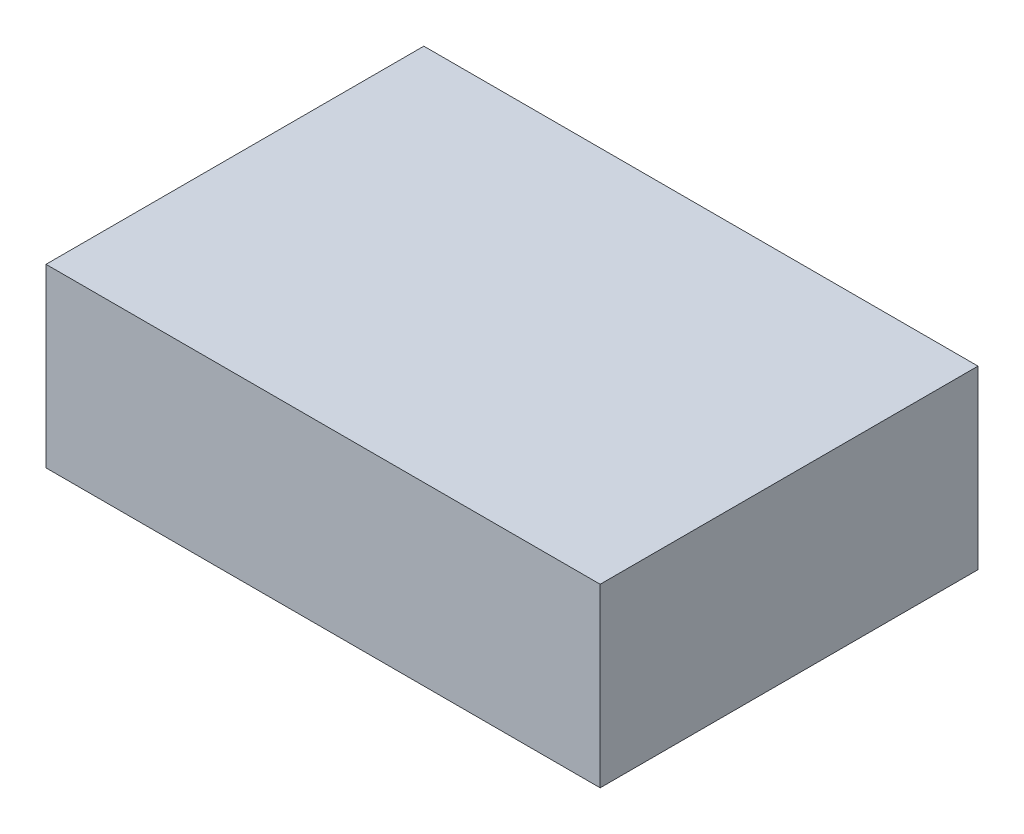
from build123d import *

# Parameters (mm, degrees)
SKETCH_1_W      = 22
SKETCH_1_H      = 7
EXTRUDE_1_DEPTH = 15


with BuildPart() as part:
    # 草圖1 → 填料-伸長1 (new body)
    with BuildSketch(Plane.XY):
        Rectangle(SKETCH_1_W, SKETCH_1_H)
    extrude(amount=EXTRUDE_1_DEPTH)


solid = part.part
